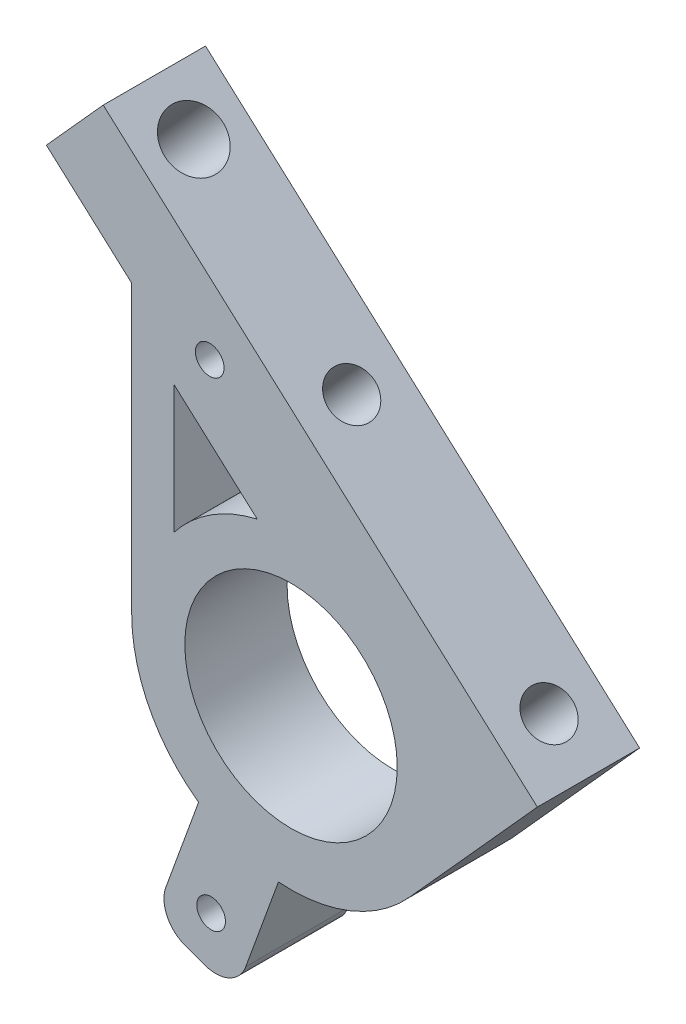
from build123d import *

# Parameters (mm, degrees)
SKETCH1_R                  = 10
EXTRUDE_3_8_DEPTH          = 9.63
BOSS_EXTRUDE2_DEPTH        = 9.63
SKETCH3_R                  = 1.35
M3_DRILL_OR_THROUGH_DEPTH  = 9.63
FILLET1_R                  = 3
SKETCH4_R                  = 2.75
M5_THROUGH_DEPTH           = 8
SKETCH5_R                  = 2.2
M5_DRILL_DEPTH             = 8
CUT_EXTRUDE4_DEPTH         = 9.63
SKETCH7_R                  = 1.35
M3_DRILL_OR_THROUGH2_DEPTH = 9.63


with BuildPart() as part:
    # Sketch1 → 3/8 (new body)
    with BuildSketch(Plane.XY):
        with BuildLine():
            Line((-15, 0), (-15, 26.962387961))
            Line((-15, 26.962387961), (-23.034486956, 34.196672509))
            Line((-23.034486956, 34.196672509), (-17.681442105, 40.141831113))
            Line((-17.681442105, 40.141831113), (23.191523297, 3.339647763))
            Line((23.191523297, 3.339647763), (17.838478446, -2.605510841))
            Line((17.838478446, -2.605510841), (11.147172382, -10.036959095))
            ThreePointArc((11.147172382, -10.036959095), (-5.375519243, -14.003706397), (-15, 0))
        make_face()
        Circle(SKETCH1_R, mode=Mode.SUBTRACT)
    extrude(amount=EXTRUDE_3_8_DEPTH)

    # Sketch2 → Boss-Extrude2 (add)
    with BuildSketch(Plane.XY):
        Polygon((-8.703298337, -12.216898054), (-1.18575737, -14.953059201), (-5.28999909, -26.22937065), (-12.807540057, -23.493209503), align=None)
    extrude(amount=BOSS_EXTRUDE2_DEPTH)

    # Sketch3 → M3_DRILL_or_Through (cut)
    with BuildSketch(Plane.XY.offset(9.63)):
        with Locations((-7.524443153, -20.673237657)):
            Circle(SKETCH3_R)
    extrude(amount=-M3_DRILL_OR_THROUGH_DEPTH, mode=Mode.SUBTRACT)

    # Fillet1
    fillet1_edges = [part.edges().sort_by_distance(p)[0] for p in [
        (-12.807540057, -23.493209503, 4.815),
        (-5.28999909, -26.22937065, 4.815),
    ]]
    fillet(fillet1_edges, radius=FILLET1_R)

    # Sketch4 → M5_through (cut)
    with BuildSketch(Plane(origin=(12.044350914, 13.376606859, 0), x_dir=(0.7431448254773932, -0.6691306063588595, 0), z_dir=(0.6691306063588595, 0.7431448254773932, 0))):
        with Locations(Location((-35, -4.815, 0), (0, 0, 180))):
            Circle(SKETCH4_R)
    extrude(amount=-M5_THROUGH_DEPTH, mode=Mode.SUBTRACT)

    # Sketch5 → M5_DRILL (cut)
    with BuildSketch(Plane(origin=(12.044350914, 13.376606859, 0), x_dir=(0.7431448254773932, -0.6691306063588595, 0), z_dir=(0.6691306063588595, 0.7431448254773932, 0))):
        with Locations(Location((-15, -4.815, 0), (0, 0, 180))):
            Circle(SKETCH5_R)
        with Locations(Location((10, -4.815, 0), (0, 0, 180))):
            Circle(SKETCH5_R)
    extrude(amount=-M5_DRILL_DEPTH, mode=Mode.SUBTRACT)

    # Sketch6 → Cut-Extrude4 (cut)
    with BuildSketch(Plane.XY.offset(9.63)):
        with BuildLine():
            Line((-11, 20.669506324), (-11, 8.660254038))
            ThreePointArc((-11, 8.660254038), (-7.515689996, 11.81162156), (-3.18503916, 13.632883978))
            Line((-3.18503916, 13.632883978), (-11, 20.669506324))
        make_face()
    extrude(amount=-CUT_EXTRUDE4_DEPTH, mode=Mode.SUBTRACT)

    # Sketch7 → M3_DRILL_or_Through2 (cut)
    with BuildSketch(Plane.XY.offset(9.63)):
        with Locations((-7.654346968, 24.385230452)):
            Circle(SKETCH7_R)
    extrude(amount=-M3_DRILL_OR_THROUGH2_DEPTH, mode=Mode.SUBTRACT)


solid = part.part
